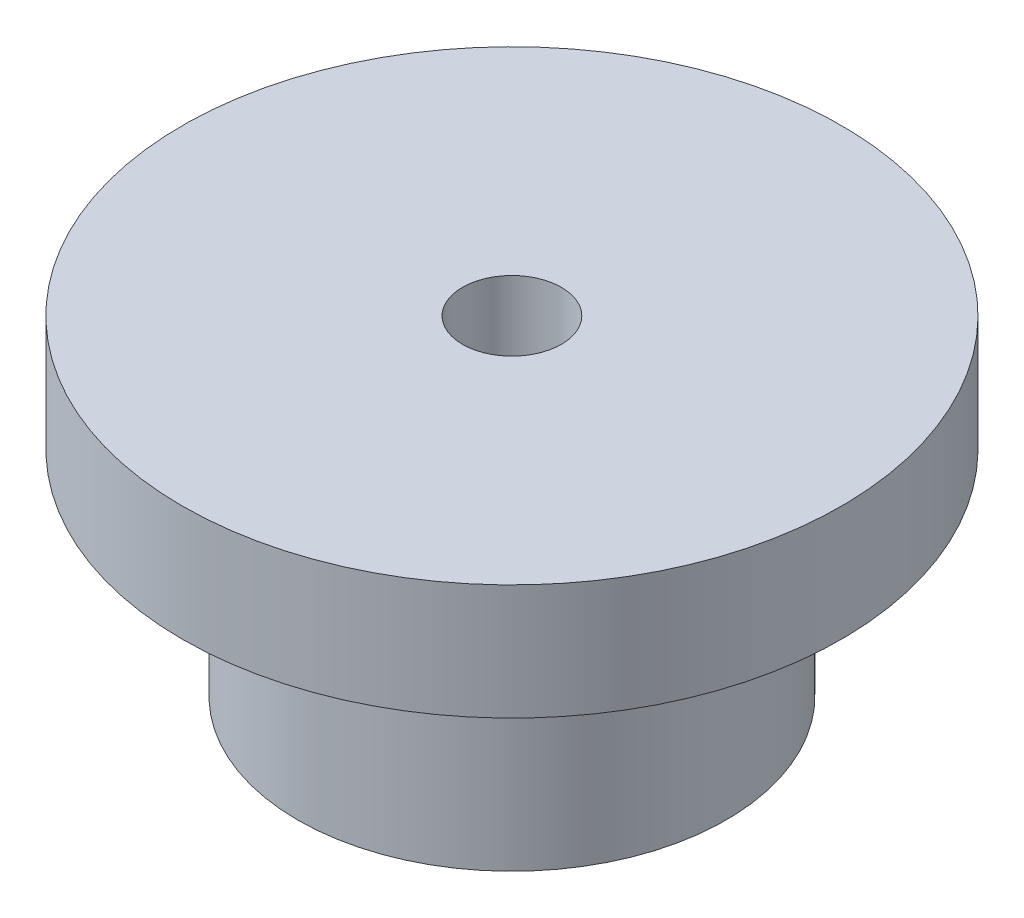
from build123d import *

# Parameters (mm, degrees)
SKETCH_1_R          = 13
EXTRUDE_1_DEPTH     = 20
SKETCH_2_R          = 5.5
CUT_EXTRUDE_2_DEPTH = 5
SKETCH_3_R          = 5
CUT_EXTRUDE_3_DEPTH = 10
CUT_EXTRUDE_3_DRAFT = -7
SKETCH_5_R          = 20
EXTRUDE_7_DEPTH     = 7
SKETCH_7_R          = 3
CUT_EXTRUDE_8_DEPTH = 35.641016151


with BuildPart() as part:
    # Эскиз1 → Вытянуть1 (new body)
    with BuildSketch(Plane(origin=(0, 0, 0), x_dir=(1, 0, 0), z_dir=(0, 1, 0))):
        with Locations(Location((0, 0, 0), (0, 0, 270))):
            Circle(SKETCH_1_R)
    extrude(amount=EXTRUDE_1_DEPTH)

    # Эскиз2 → Вытянуть2 (cut)
    with BuildSketch(Plane.XZ):
        with Locations(Location((0, 0, 0), (0, 0, 270))):
            Circle(SKETCH_2_R)
    extrude(amount=-CUT_EXTRUDE_2_DEPTH, mode=Mode.SUBTRACT)


with BuildPart() as cut_extrude_3_tool:
    # Эскиз3 → Вытянуть3 (with draft: the straight prism first)
    with BuildSketch(Plane.XZ.offset(-5)):
        Circle(SKETCH_3_R)
    extrude(amount=-CUT_EXTRUDE_3_DEPTH)
    # Вытянуть3: the draft: its side faces are tilted about the plane it starts from
    cut_extrude_3_sides = [cut_extrude_3_tool.faces().sort_by_distance(p)[0] for p in [
        (-5, 10, 0),
    ]]
    draft(cut_extrude_3_sides, Plane.XZ.offset(-5), CUT_EXTRUDE_3_DRAFT)


with BuildPart() as part_1:
    add(part.part)

    # Вытянуть3: cut by cut_extrude_3_tool
    add(cut_extrude_3_tool.part, mode=Mode.SUBTRACT)

    # Эскиз5 → Вытянуть7 (add)
    with BuildSketch(Plane(origin=(0, 20, 0), x_dir=(-1, 0, 0), z_dir=(0, 1, 0))):
        with Locations(Location((0, 0, 0), (0, 0, 90))):
            Circle(SKETCH_5_R)
    extrude(amount=-EXTRUDE_7_DEPTH)

    # Эскиз7 → Вытянуть8 (cut, through all)
    with BuildSketch(Plane(origin=(0, 20, 0), x_dir=(1, 0, 0), z_dir=(0, 1, 0))):
        with Locations(Location((0, 0, 0), (0, 0, 270))):
            Circle(SKETCH_7_R)
    extrude(amount=-CUT_EXTRUDE_8_DEPTH, mode=Mode.SUBTRACT)


solid = part_1.part
